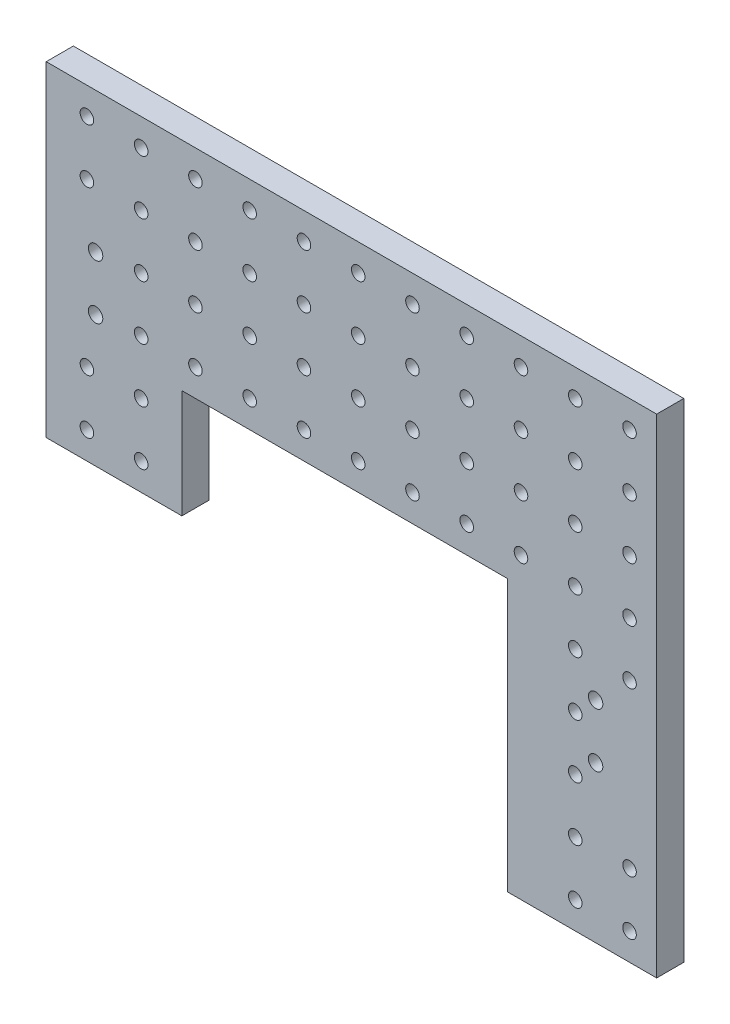
from build123d import *

# Parameters (mm, degrees)
SKETCH1_R           = 3.175
BOSS_EXTRUDE1_DEPTH = 12.7
SKETCH2_R           = 3.175
CUT_EXTRUDE1_DEPTH  = 12.7
SKETCH3_R           = 3.3734375
CUT_EXTRUDE2_DEPTH  = 12.7
CUT_EXTRUDE3_START  = -6.35
SKETCH3_3_R         = 5.55625
SKETCH3_3_R_2       = 3.3734375
SKETCH3_3_R_3       = 5.588
SKETCH3_3_R_4       = 3.429
CUT_EXTRUDE3_DEPTH  = 6.35
SKETCH5_R           = 3.3734375
CUT_EXTRUDE4_DEPTH  = 12.7
SKETCH5_3_R         = 5.55625
SKETCH5_3_R_2       = 3.3734375
CUT_EXTRUDE5_DEPTH  = 6.35


with BuildPart() as part:
    # Sketch1 → Boss-Extrude1 (new body)
    with BuildSketch(Plane.XY):
        Polygon((0, 152.4), (0, 0), (63.5, 0), (63.5, 50.8), (215.9, 50.8), (215.9, -76.2), (285.75, -76.2), (285.75, 152.4), align=None)
        with Locations((19.05, 12.7)):
            Circle(SKETCH1_R, mode=Mode.SUBTRACT)
        with Locations((19.05, 38.1)):
            Circle(SKETCH1_R, mode=Mode.SUBTRACT)
        with Locations((44.45, 12.7)):
            Circle(SKETCH1_R, mode=Mode.SUBTRACT)
        with Locations((44.45, 38.1)):
            Circle(SKETCH1_R, mode=Mode.SUBTRACT)
        with Locations((247.65, 12.7)):
            Circle(SKETCH1_R, mode=Mode.SUBTRACT)
        with Locations((247.65, 38.1)):
            Circle(SKETCH1_R, mode=Mode.SUBTRACT)
        with Locations((44.45, 63.5)):
            Circle(SKETCH1_R, mode=Mode.SUBTRACT)
        with Locations((69.85, 63.5)):
            Circle(SKETCH1_R, mode=Mode.SUBTRACT)
        with Locations((44.45, 88.9)):
            Circle(SKETCH1_R, mode=Mode.SUBTRACT)
        with Locations((69.85, 88.9)):
            Circle(SKETCH1_R, mode=Mode.SUBTRACT)
        with Locations((95.25, 63.5)):
            Circle(SKETCH1_R, mode=Mode.SUBTRACT)
        with Locations((120.65, 63.5)):
            Circle(SKETCH1_R, mode=Mode.SUBTRACT)
        with Locations((95.25, 88.9)):
            Circle(SKETCH1_R, mode=Mode.SUBTRACT)
        with Locations((120.65, 88.9)):
            Circle(SKETCH1_R, mode=Mode.SUBTRACT)
        with Locations((19.05, 114.3)):
            Circle(SKETCH1_R, mode=Mode.SUBTRACT)
        with Locations((44.45, 114.3)):
            Circle(SKETCH1_R, mode=Mode.SUBTRACT)
        with Locations((69.85, 114.3)):
            Circle(SKETCH1_R, mode=Mode.SUBTRACT)
        with Locations((19.05, 139.7)):
            Circle(SKETCH1_R, mode=Mode.SUBTRACT)
        with Locations((44.45, 139.7)):
            Circle(SKETCH1_R, mode=Mode.SUBTRACT)
        with Locations((69.85, 139.7)):
            Circle(SKETCH1_R, mode=Mode.SUBTRACT)
        with Locations((95.25, 114.3)):
            Circle(SKETCH1_R, mode=Mode.SUBTRACT)
        with Locations((120.65, 114.3)):
            Circle(SKETCH1_R, mode=Mode.SUBTRACT)
        with Locations((95.25, 139.7)):
            Circle(SKETCH1_R, mode=Mode.SUBTRACT)
        with Locations((120.65, 139.7)):
            Circle(SKETCH1_R, mode=Mode.SUBTRACT)
        with Locations((146.05, 63.5)):
            Circle(SKETCH1_R, mode=Mode.SUBTRACT)
        with Locations((171.45, 63.5)):
            Circle(SKETCH1_R, mode=Mode.SUBTRACT)
        with Locations((196.85, 63.5)):
            Circle(SKETCH1_R, mode=Mode.SUBTRACT)
        with Locations((146.05, 88.9)):
            Circle(SKETCH1_R, mode=Mode.SUBTRACT)
        with Locations((171.45, 88.9)):
            Circle(SKETCH1_R, mode=Mode.SUBTRACT)
        with Locations((196.85, 88.9)):
            Circle(SKETCH1_R, mode=Mode.SUBTRACT)
        with Locations((222.25, 63.5)):
            Circle(SKETCH1_R, mode=Mode.SUBTRACT)
        with Locations((247.65, 63.5)):
            Circle(SKETCH1_R, mode=Mode.SUBTRACT)
        with Locations((273.05, 63.5)):
            Circle(SKETCH1_R, mode=Mode.SUBTRACT)
        with Locations((222.25, 88.9)):
            Circle(SKETCH1_R, mode=Mode.SUBTRACT)
        with Locations((247.65, 88.9)):
            Circle(SKETCH1_R, mode=Mode.SUBTRACT)
        with Locations((273.05, 88.9)):
            Circle(SKETCH1_R, mode=Mode.SUBTRACT)
        with Locations((146.05, 114.3)):
            Circle(SKETCH1_R, mode=Mode.SUBTRACT)
        with Locations((171.45, 114.3)):
            Circle(SKETCH1_R, mode=Mode.SUBTRACT)
        with Locations((196.85, 114.3)):
            Circle(SKETCH1_R, mode=Mode.SUBTRACT)
        with Locations((146.05, 139.7)):
            Circle(SKETCH1_R, mode=Mode.SUBTRACT)
        with Locations((171.45, 139.7)):
            Circle(SKETCH1_R, mode=Mode.SUBTRACT)
        with Locations((196.85, 139.7)):
            Circle(SKETCH1_R, mode=Mode.SUBTRACT)
        with Locations((222.25, 114.3)):
            Circle(SKETCH1_R, mode=Mode.SUBTRACT)
        with Locations((247.65, 114.3)):
            Circle(SKETCH1_R, mode=Mode.SUBTRACT)
        with Locations((273.05, 114.3)):
            Circle(SKETCH1_R, mode=Mode.SUBTRACT)
        with Locations((222.25, 139.7)):
            Circle(SKETCH1_R, mode=Mode.SUBTRACT)
        with Locations((247.65, 139.7)):
            Circle(SKETCH1_R, mode=Mode.SUBTRACT)
        with Locations((273.05, 139.7)):
            Circle(SKETCH1_R, mode=Mode.SUBTRACT)
    extrude(amount=BOSS_EXTRUDE1_DEPTH)

    # Sketch2 → Cut-Extrude1 (cut)
    with BuildSketch(Plane.XY.offset(12.7)):
        with Locations((247.65, -12.7)):
            Circle(SKETCH2_R)
        with Locations((247.65, -38.1)):
            Circle(SKETCH2_R)
        with Locations((247.65, -63.5)):
            Circle(SKETCH2_R)
        with Locations((273.05, -38.1)):
            Circle(SKETCH2_R)
        with Locations((273.05, -63.5)):
            Circle(SKETCH2_R)
        with Locations((273.05, 38.1)):
            Circle(SKETCH2_R)
    extrude(amount=-CUT_EXTRUDE1_DEPTH, mode=Mode.SUBTRACT)

    # Sketch3 → Cut-Extrude2 (cut)
    with BuildSketch(Plane.XY.offset(12.7)):
        with Locations((257.175, -3.2258)):
            Circle(SKETCH3_R)
        with Locations((257.175, 22.1742)):
            Circle(SKETCH3_R)
    extrude(amount=-CUT_EXTRUDE2_DEPTH, mode=Mode.SUBTRACT)

    # Sketch3<3> → Cut-Extrude3 (cut)
    # profile 1 of 4: a face of its own
    with BuildSketch(Plane.XY.offset(12.7).offset(CUT_EXTRUDE3_START)):
        with Locations((257.175, -3.2258)):
            Circle(SKETCH3_3_R)
        with Locations((257.175, -3.2258)):
            Circle(SKETCH3_3_R_2, mode=Mode.SUBTRACT)
    # profile 2 of 4: a face of its own
    with BuildSketch(Plane.XY.offset(12.7).offset(CUT_EXTRUDE3_START)):
        with Locations((257.175, 22.1742)):
            Circle(SKETCH3_3_R)
        with Locations((257.175, 22.1742)):
            Circle(SKETCH3_3_R_2, mode=Mode.SUBTRACT)
    # profile 3 of 4: a face of its own
    with BuildSketch(Plane.XY.offset(12.7).offset(CUT_EXTRUDE3_START)):
        with Locations((257.175, 120.082847609)):
            Circle(SKETCH3_3_R_3)
        with Locations((257.175, 120.082847609)):
            Circle(SKETCH3_3_R_4, mode=Mode.SUBTRACT)
    # profile 4 of 4: a face of its own
    with BuildSketch(Plane.XY.offset(12.7).offset(CUT_EXTRUDE3_START)):
        with Locations((257.175, 94.682847609)):
            Circle(SKETCH3_3_R_3)
        with Locations((257.175, 94.682847609)):
            Circle(SKETCH3_3_R_4, mode=Mode.SUBTRACT)
    extrude(amount=-CUT_EXTRUDE3_DEPTH, mode=Mode.SUBTRACT)

    # Sketch5 → Cut-Extrude4 (cut)
    with BuildSketch(Plane(origin=(0, 0, 0), x_dir=(-1, 0, 0), z_dir=(0, 0, -1))):
        with Locations((-23.114, 61.3918)):
            Circle(SKETCH5_R)
        with Locations((-23.114, 86.7918)):
            Circle(SKETCH5_R)
    extrude(amount=-CUT_EXTRUDE4_DEPTH, mode=Mode.SUBTRACT)

    # Sketch5<3> → Cut-Extrude5 (cut)
    # profile 1 of 2: a face of its own
    with BuildSketch(Plane(origin=(0, 0, 0), x_dir=(-1, 0, 0), z_dir=(0, 0, -1))):
        with Locations(Location((-23.114, 61.3918, 0), (0, 0, 180))):
            Circle(SKETCH5_3_R)
        with Locations((-23.114, 61.3918)):
            Circle(SKETCH5_3_R_2, mode=Mode.SUBTRACT)
    # profile 2 of 2: a face of its own
    with BuildSketch(Plane(origin=(0, 0, 0), x_dir=(-1, 0, 0), z_dir=(0, 0, -1))):
        with Locations(Location((-23.114, 86.7918, 0), (0, 0, 180))):
            Circle(SKETCH5_3_R)
        with Locations((-23.114, 86.7918)):
            Circle(SKETCH5_3_R_2, mode=Mode.SUBTRACT)
    extrude(amount=-CUT_EXTRUDE5_DEPTH, mode=Mode.SUBTRACT)


solid = part.part
